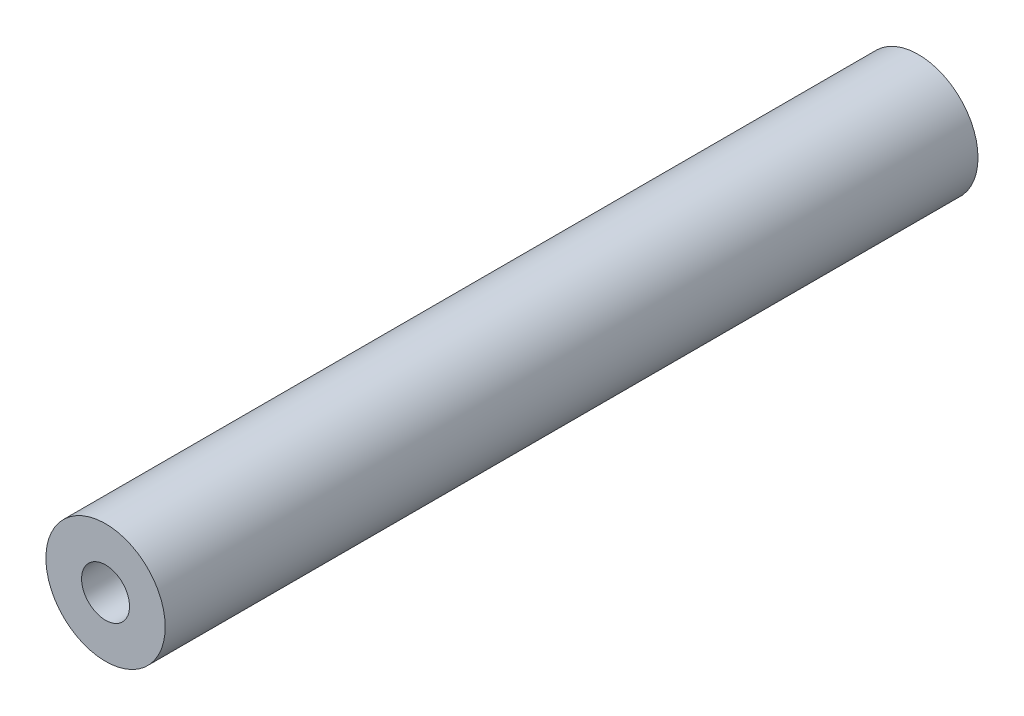
from build123d import *

# Parameters (mm, degrees)
SKETCH1_R           = 6.35
BOSS_EXTRUDE1_DEPTH = 43.258347316


with BuildPart() as part:
    # Sketch1 → Boss-Extrude1 (new, symmetric)
    with BuildSketch(Plane.XY):
        Circle(SKETCH1_R)
    extrude(amount=BOSS_EXTRUDE1_DEPTH, both=True)

    # Sketch3 → Tap Drill for 1/4-20 Tap1 (revolve, cut)
    with BuildSketch(Plane(origin=(0, 0, 43.258347316), x_dir=(0, -1, 0), z_dir=(1, 0, 0))):
        Polygon((0, 0), (0, 17.408816902), (2.5527, 15.875), (2.5527, 0), align=None)
    tap_drill_for_1_4_20_tap1 = revolve(axis=Axis((0, 0, 49.608347316), (0, 0, -1)), mode=Mode.SUBTRACT)

    # Mirror1: Tap Drill for 1/4-20 Tap1 across plane
    add(tap_drill_for_1_4_20_tap1.mirror(Plane.XY), mode=Mode.SUBTRACT)


solid = part.part
